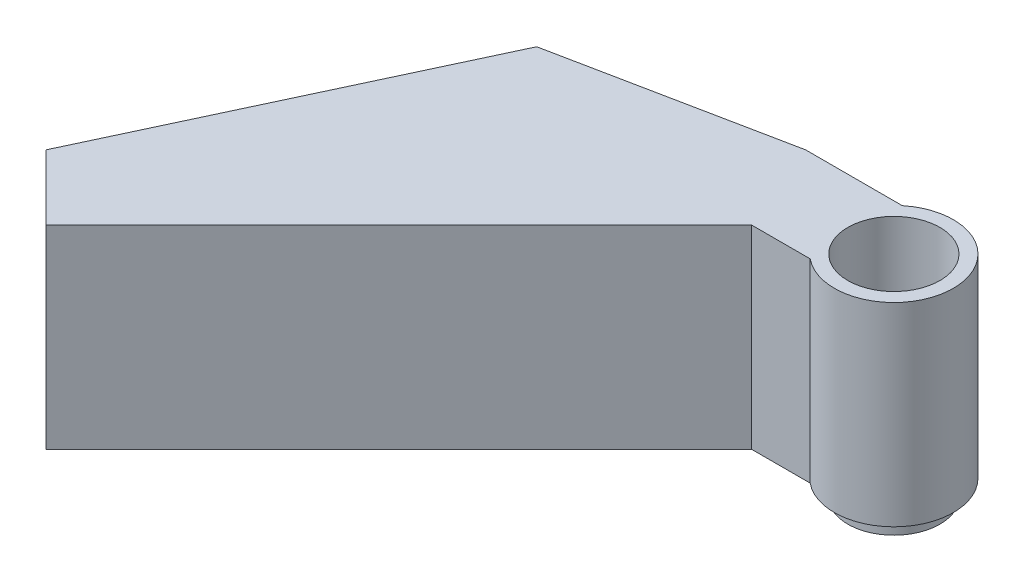
from build123d import *

# Parameters (mm, degrees)
SKETCH1_R            = 3.43
SKETCH1_R_2          = 1.235
MAIN_BODY_DEPTH      = 4.715
SKETCH2_R            = 2.45
TOP_SCREW_HOLE_DEPTH = 0.865
MAKE_START           = -3.465
MAKE_WINGS_DEPTH     = 14.465
SKETCH4_R            = 2.5
SPLINE_HOLE_DEPTH    = 2.8
SKETCH5_W            = 6.86
SKETCH5_H            = 14.465
BOSS_EXTRUDE1_DEPTH  = 5
BOSS_EXTRUDE2_DEPTH  = 14.465
BOSS_EXTRUDE3_DEPTH  = 14.465
BOSS_EXTRUDE4_START  = -14.465
BOSS_EXTRUDE4_DEPTH  = 14.465
CUT_EXTRUDE1_DEPTH   = 51.941486893


with BuildPart() as part:
    # Sketch1 → main body (new body)
    with BuildSketch(Plane(origin=(0, 0, 0), x_dir=(1, 0, 0), z_dir=(0, 1, 0))):
        with Locations(Location((0, 0, 0), (0, 0, 90))):
            Circle(SKETCH1_R)
        with Locations(Location((0, 0, 0), (0, 0, 90))):
            Circle(SKETCH1_R_2, mode=Mode.SUBTRACT)
    extrude(amount=MAIN_BODY_DEPTH)

    # Sketch2 → top screw hole (cut)
    with BuildSketch(Plane(origin=(0, 4.715, 0), x_dir=(1, 0, 0), z_dir=(0, 1, 0))):
        with Locations(Location((0, 0, 0), (0, 0, 270))):
            Circle(SKETCH2_R)
    extrude(amount=-TOP_SCREW_HOLE_DEPTH, mode=Mode.SUBTRACT)

    # Sketch3 → make wings (add)
    with BuildSketch(Plane(origin=(0, 4.715, 0), x_dir=(1, 0, 0), z_dir=(0, 1, 0)).offset(MAKE_START)):
        with BuildLine():
            ThreePointArc((0, -3.43), (-3.43, 0), (0, 3.43))
            Line((0, 3.43), (-6.57, 3.43))
            ThreePointArc((-6.57, 3.43), (-10, 0), (-6.57, -3.43))
            Line((-6.57, -3.43), (0, -3.43))
        make_face()
    extrude(amount=MAKE_WINGS_DEPTH)

    # Sketch4 → spline hole (cut)
    with BuildSketch(Plane.XZ):
        with Locations(Location((0, 0, 0), (0, 0, 270))):
            Circle(SKETCH4_R)
    extrude(amount=-SPLINE_HOLE_DEPTH, mode=Mode.SUBTRACT)

    # Sketch5 → Boss-Extrude1 (add)
    with BuildSketch(Plane.ZY.offset(10)):
        with Locations((0, 8.4825)):
            Rectangle(SKETCH5_W, SKETCH5_H)
    extrude(amount=-BOSS_EXTRUDE1_DEPTH)

    # Sketch6 → Boss-Extrude2 (add)
    with BuildSketch(Plane(origin=(0, 15.715, 0), x_dir=(1, 0, 0), z_dir=(0, 1, 0))):
        Polygon((-10, 3.43), (-38.284271247, -24.854271247), (-33.433518729, -29.705023766), (-5.149247481, -1.420752519), align=None)
    extrude(amount=-BOSS_EXTRUDE2_DEPTH)

    # Sketch7 → Boss-Extrude3 (add)
    with BuildSketch(Plane(origin=(0, 15.715, 0), x_dir=(1, 0, 0), z_dir=(0, 1, 0))):
        Polygon((-38.284271247, -24.854271247), (-20.294632832, 13.724632832), (-10, 3.43), align=None)
    extrude(amount=-BOSS_EXTRUDE3_DEPTH)

    # Sketch9 → Boss-Extrude4 (add)
    with BuildSketch(Plane(origin=(0, 15.715, 0), x_dir=(1, 0, 0), z_dir=(0, 1, 0)).offset(BOSS_EXTRUDE4_START)):
        with BuildLine():
            Line((0, 3.43), (-2.803569154, 3.43))
            ThreePointArc((-2.803569154, 3.43), (4.43, 0), (-2.803569154, -3.43))
            Line((-2.803569154, -3.43), (0, -3.43))
            ThreePointArc((0, -3.43), (3.43, 0), (0, 3.43))
        make_face()
    extrude(amount=BOSS_EXTRUDE4_DEPTH)

    # Sketch10 → Cut-Extrude1 (cut, through all)
    with BuildSketch(Plane(origin=(0, 15.715, 0), x_dir=(1, 0, 0), z_dir=(0, 1, 0))):
        Polygon((-10, 3.43), (-26.663813955, 0.065879836), (-20.294632832, 13.724632832), align=None)
    extrude(amount=-CUT_EXTRUDE1_DEPTH, mode=Mode.SUBTRACT)


solid = part.part
